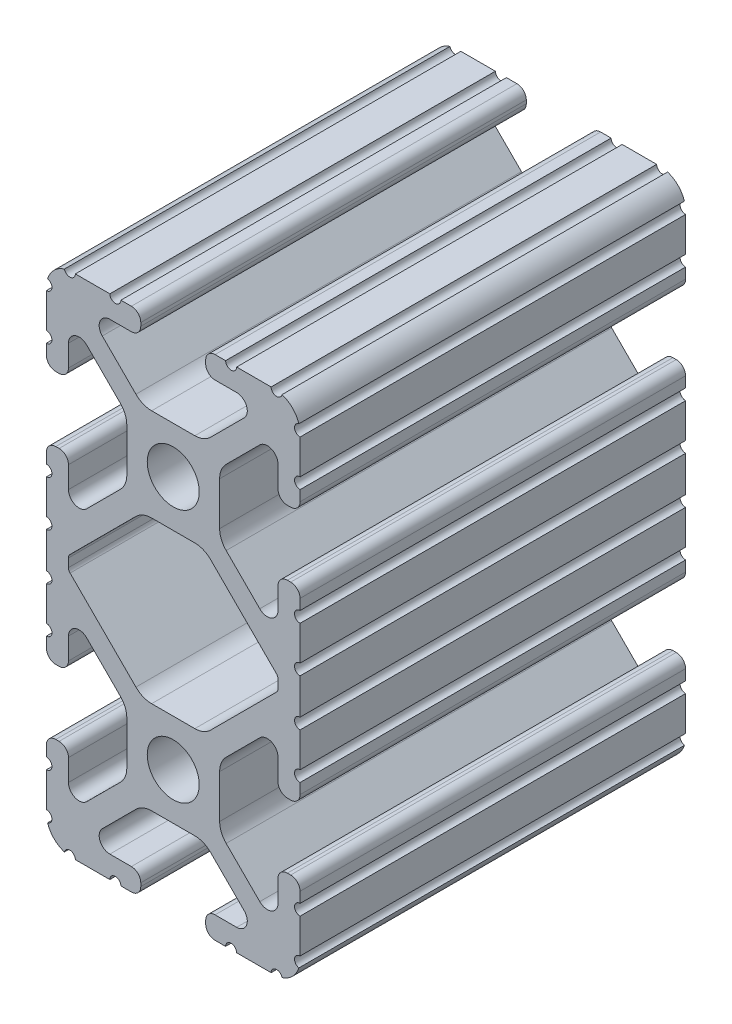
from build123d import *

# Parameters (mm, degrees)
BOSS_EXTRUDE1_DEPTH     = 76.2
CUT_EXTRUDE1_DEPTH      = 82.319677815
CUT_EXTRUDE1_DEPTH_BACK = 82.319677815
SKETCH5_R               = 0.55245
BOSS_EXTRUDE2_DEPTH     = 76.2
CUT_EXTRUDE2_DEPTH      = 82.319677815
CUT_EXTRUDE2_DEPTH_BACK = 82.319677815
SKETCH8_W               = 48.4456509
SKETCH8_H               = 64.339711884
CUT_EXTRUDE3_DEPTH      = 113.792


with BuildPart() as part:
    # Sketch4 → Boss-Extrude1 (new, symmetric)
    with BuildSketch(Plane.XY):
        with BuildLine():
            Line((4.190365, -25.4), (10.11729625, -25.4))
            ThreePointArc((10.11729625, -25.4), (11.943543585, -24.643543585), (12.7, -22.81729625))
            Line((12.7, -22.81729625), (12.7, -16.890365))
            ThreePointArc((12.7, -16.890365), (12.42492494, -16.22627506), (11.760835, -15.9512))
            Line((11.760835, -15.9512), (11.429365, -15.9512))
            ThreePointArc((11.429365, -15.9512), (10.76527506, -16.22627506), (10.4902, -16.890365))
            Line((10.4902, -16.890365), (10.4902, -19.048478019))
            ThreePointArc((10.4902, -19.048478019), (9.830707141, -20.035478831), (8.666460301, -19.803895736))
            Line((8.666460301, -19.803895736), (5.299899128, -16.437334563))
            ThreePointArc((5.299899128, -16.437334563), (4.817571085, -15.715479634), (4.6482, -14.86399369))
            Line((4.6482, -14.86399369), (4.6482, -12.7))
            Line((4.6482, -12.7), (2.6035, -12.7))
            ThreePointArc((2.6035, -12.7), (1.840952505, -14.540952505), (0, -15.3035))
            Line((0, -15.3035), (0, -17.3482))
            Line((0, -17.3482), (2.16399369, -17.3482))
            ThreePointArc((2.16399369, -17.3482), (3.015479634, -17.517571085), (3.737334563, -17.999899128))
            Line((3.737334563, -17.999899128), (7.103895736, -21.366460301))
            ThreePointArc((7.103895736, -21.366460301), (7.335478831, -22.530707141), (6.348478019, -23.1902))
            Line((6.348478019, -23.1902), (4.190365, -23.1902))
            ThreePointArc((4.190365, -23.1902), (3.52627506, -23.46527506), (3.2512, -24.129365))
            Line((3.2512, -24.129365), (3.2512, -24.460835))
            ThreePointArc((3.2512, -24.460835), (3.52627506, -25.12492494), (4.190365, -25.4))
        make_face()
    extrude(amount=BOSS_EXTRUDE1_DEPTH, both=True)

    # Sketch5 → Cut-Extrude1 (cut, two sides: drawn at the far end of the back side and taken through both)
    with BuildSketch(Plane.XY.offset(-CUT_EXTRUDE1_DEPTH_BACK)):
        with Locations((10.356153152, -25.4)):
            Circle(SKETCH5_R)
        with Locations((5.796028019, -25.4)):
            Circle(SKETCH5_R)
        with Locations((12.7, -23.056153152)):
            Circle(SKETCH5_R)
        with Locations((12.7, -18.496028019)):
            Circle(SKETCH5_R)
    extrude(amount=CUT_EXTRUDE1_DEPTH + CUT_EXTRUDE1_DEPTH_BACK, mode=Mode.SUBTRACT)

    # Mirror1: part across plane


with BuildPart() as part_1:
    add(part.part)
    add(part.part.mirror(Plane(origin=(4.6482, -12.7, 76.2), x_dir=(0, 0, 1), z_dir=(0, -1, 0))))

    # Sketch6 → Boss-Extrude2 (add, symmetric)
    with BuildSketch(Plane.XY):
        with BuildLine():
            Line((12.7, -1.791396848), (12.7, 0))
            Line((12.7, 0), (9.803703152, 0))
            Line((9.803703152, 0), (9.803703152, -2.343846848))
            Line((9.803703152, -2.343846848), (12.14755, -2.343846848))
            ThreePointArc((12.14755, -2.343846848), (12.309358859, -1.953205706), (12.7, -1.791396848))
        make_face()
    extrude(amount=BOSS_EXTRUDE2_DEPTH, both=True)

    # Sketch7 → Cut-Extrude2 (cut, two sides: drawn at the far end of the back side and taken through both)
    with BuildSketch(Plane.XY.offset(-CUT_EXTRUDE2_DEPTH_BACK)):
        with BuildLine():
            Line((5.420615149, -5.716820286), (10.328391141, -0.809044294))
            ThreePointArc((10.328391141, -0.809044294), (10.448147248, -0.629816615), (10.4902, -0.418403152))
            Line((10.4902, -0.418403152), (10.4902, 0))
            Line((10.4902, 0), (0, 0))
            Line((0, 0), (5.420615149, -5.716820286))
        make_face()
    extrude(amount=CUT_EXTRUDE2_DEPTH + CUT_EXTRUDE2_DEPTH_BACK, mode=Mode.SUBTRACT)

    # Mirror2: part across plane


with BuildPart() as part_2:
    add(part_1.part)
    add(part_1.part.mirror(Plane.ZX))

    # Mirror3: part across plane


with BuildPart() as part_3:
    add(part_2.part)
    add(part_2.part.mirror(Plane(origin=(0, 0, 0), x_dir=(0, 0, 1), z_dir=(1, 0, 0))))

    # Sketch8 → Cut-Extrude3 (cut)
    with BuildSketch(Plane(origin=(0, 0, -76.2), x_dir=(-1, 0, 0), z_dir=(0, 0, -1))):
        Rectangle(SKETCH8_W, SKETCH8_H)
    extrude(amount=-CUT_EXTRUDE3_DEPTH, mode=Mode.SUBTRACT)


solid = part_3.part
